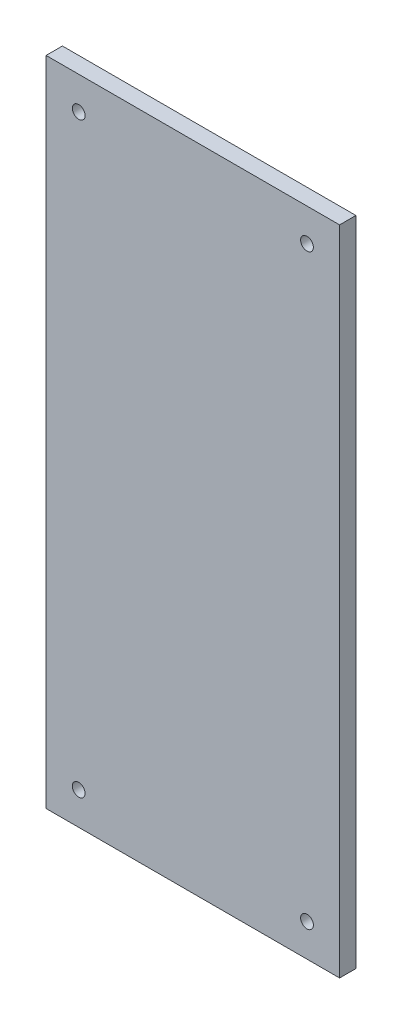
from build123d import *

# Parameters (mm, degrees)
SKETCH1_W           = 114.3
SKETCH1_H           = 254
BOSS_EXTRUDE1_DEPTH = 3.175
SKETCH2_R           = 2.4892
CUT_EXTRUDE1_DEPTH  = 279.6051193


with BuildPart() as part:
    # Sketch1 → Boss-Extrude1 (new, symmetric)
    with BuildSketch(Plane.XY):
        with Locations((57.15, 127)):
            Rectangle(SKETCH1_W, SKETCH1_H)
    extrude(amount=BOSS_EXTRUDE1_DEPTH, both=True)

    # Sketch2 → Cut-Extrude1 (cut, through all)
    with BuildSketch(Plane.XY.offset(3.175)):
        with Locations((12.7, 241.3)):
            Circle(SKETCH2_R)
        with Locations((12.7, 12.7)):
            Circle(SKETCH2_R)
        with Locations((101.6, 241.3)):
            Circle(SKETCH2_R)
        with Locations((101.6, 12.7)):
            Circle(SKETCH2_R)
    extrude(amount=-CUT_EXTRUDE1_DEPTH, mode=Mode.SUBTRACT)


solid = part.part
